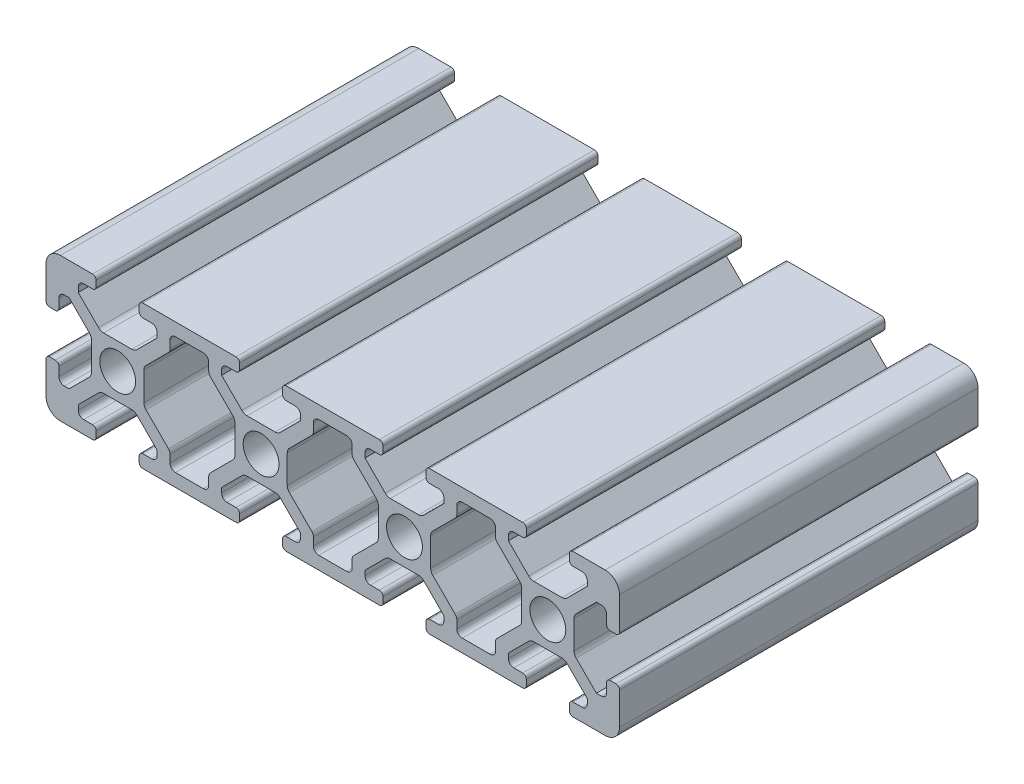
from build123d import *

# Parameters (mm, degrees)
SKETCH1_R           = 2.5
BOSS_EXTRUDE1_DEPTH = 50


with BuildPart() as part:
    # Sketch1 → Boss-Extrude1 (new body)
    with BuildSketch(Plane.XY):
        with BuildLine():
            Line((2, 0), (6.5, 0))
            ThreePointArc((6.5, 0), (6.853553391, 0.146446609), (7, 0.5))
            Line((7, 0.5), (7, 1.3))
            ThreePointArc((7, 1.3), (6.853553391, 1.653553391), (6.5, 1.8))
            Line((6.5, 1.8), (5.25, 1.8))
            ThreePointArc((5.25, 1.8), (4.719669914, 2.019669914), (4.5, 2.55))
            Line((4.5, 2.55), (4.5, 3.227207794))
            Line((4.5, 3.227207794), (7.329898987, 6.057106781))
            ThreePointArc((7.329898987, 6.057106781), (7.654322336, 6.273879533), (8.037005769, 6.35))
            Line((8.037005769, 6.35), (11.962994231, 6.35))
            ThreePointArc((11.962994231, 6.35), (12.345677664, 6.273879533), (12.670101013, 6.057106781))
            Line((12.670101013, 6.057106781), (15.5, 3.227207794))
            Line((15.5, 3.227207794), (15.5, 2.55))
            ThreePointArc((15.5, 2.55), (15.280330086, 2.019669914), (14.75, 1.8))
            Line((14.75, 1.8), (13.5, 1.8))
            ThreePointArc((13.5, 1.8), (13.146446609, 1.653553391), (13, 1.3))
            Line((13, 1.3), (13, 0.5))
            ThreePointArc((13, 0.5), (13.146446609, 0.146446609), (13.5, 0))
            Line((13.5, 0), (26.5, 0))
            ThreePointArc((26.5, 0), (26.853553391, 0.146446609), (27, 0.5))
            Line((27, 0.5), (27, 1.3))
            ThreePointArc((27, 1.3), (26.853553391, 1.653553391), (26.5, 1.8))
            Line((26.5, 1.8), (25.25, 1.8))
            ThreePointArc((25.25, 1.8), (24.719669914, 2.019669914), (24.5, 2.55))
            Line((24.5, 2.55), (24.5, 3.227207794))
            Line((24.5, 3.227207794), (27.329898987, 6.057106781))
            ThreePointArc((27.329898987, 6.057106781), (27.654322336, 6.273879533), (28.037005769, 6.35))
            Line((28.037005769, 6.35), (31.962994231, 6.35))
            ThreePointArc((31.962994231, 6.35), (32.345677664, 6.273879533), (32.670101013, 6.057106781))
            Line((32.670101013, 6.057106781), (35.5, 3.227207794))
            Line((35.5, 3.227207794), (35.5, 2.55))
            ThreePointArc((35.5, 2.55), (35.280330086, 2.019669914), (34.75, 1.8))
            Line((34.75, 1.8), (33.5, 1.8))
            ThreePointArc((33.5, 1.8), (33.146446609, 1.653553391), (33, 1.3))
            Line((33, 1.3), (33, 0.5))
            ThreePointArc((33, 0.5), (33.146446609, 0.146446609), (33.5, 0))
            Line((33.5, 0), (46.5, 0))
            ThreePointArc((46.5, 0), (46.853553391, 0.146446609), (47, 0.5))
            Line((47, 0.5), (47, 1.3))
            ThreePointArc((47, 1.3), (46.853553391, 1.653553391), (46.5, 1.8))
            Line((46.5, 1.8), (45.25, 1.8))
            ThreePointArc((45.25, 1.8), (44.719669914, 2.019669914), (44.5, 2.55))
            Line((44.5, 2.55), (44.5, 3.227207794))
            Line((44.5, 3.227207794), (47.329898987, 6.057106781))
            ThreePointArc((47.329898987, 6.057106781), (47.654322336, 6.273879533), (48.037005769, 6.35))
            Line((48.037005769, 6.35), (51.962994231, 6.35))
            ThreePointArc((51.962994231, 6.35), (52.345677664, 6.273879533), (52.670101013, 6.057106781))
            Line((52.670101013, 6.057106781), (55.5, 3.227207794))
            Line((55.5, 3.227207794), (55.5, 2.55))
            ThreePointArc((55.5, 2.55), (55.280330086, 2.019669914), (54.75, 1.8))
            Line((54.75, 1.8), (53.5, 1.8))
            ThreePointArc((53.5, 1.8), (53.146446609, 1.653553391), (53, 1.3))
            Line((53, 1.3), (53, 0.5))
            ThreePointArc((53, 0.5), (53.146446609, 0.146446609), (53.5, 0))
            Line((53.5, 0), (66.5, 0))
            ThreePointArc((66.5, 0), (66.853553391, 0.146446609), (67, 0.5))
            Line((67, 0.5), (67, 1.3))
            ThreePointArc((67, 1.3), (66.853553391, 1.653553391), (66.5, 1.8))
            Line((66.5, 1.8), (65.25, 1.8))
            ThreePointArc((65.25, 1.8), (64.719669914, 2.019669914), (64.5, 2.55))
            Line((64.5, 2.55), (64.5, 3.227207794))
            Line((64.5, 3.227207794), (67.329898987, 6.057106781))
            ThreePointArc((67.329898987, 6.057106781), (67.654322336, 6.273879533), (68.037005769, 6.35))
            Line((68.037005769, 6.35), (71.962994231, 6.35))
            ThreePointArc((71.962994231, 6.35), (72.345677664, 6.273879533), (72.670101013, 6.057106781))
            Line((72.670101013, 6.057106781), (75.5, 3.227207794))
            Line((75.5, 3.227207794), (75.5, 2.55))
            ThreePointArc((75.5, 2.55), (75.280330086, 2.019669914), (74.75, 1.8))
            Line((74.75, 1.8), (73.5, 1.8))
            ThreePointArc((73.5, 1.8), (73.146446609, 1.653553391), (73, 1.3))
            Line((73, 1.3), (73, 0.5))
            ThreePointArc((73, 0.5), (73.146446609, 0.146446609), (73.5, 0))
            Line((73.5, 0), (78, 0))
            ThreePointArc((78, 0), (79.414213562, 0.585786438), (80, 2))
            Line((80, 2), (80, 6.5))
            ThreePointArc((80, 6.5), (79.853553391, 6.853553391), (79.5, 7))
            Line((79.5, 7), (78.7, 7))
            ThreePointArc((78.7, 7), (78.346446609, 6.853553391), (78.2, 6.5))
            Line((78.2, 6.5), (78.2, 5.25))
            ThreePointArc((78.2, 5.25), (77.980330086, 4.719669914), (77.45, 4.5))
            Line((77.45, 4.5), (76.772792206, 4.5))
            Line((76.772792206, 4.5), (73.942893219, 7.329898987))
            ThreePointArc((73.942893219, 7.329898987), (73.726120467, 7.654322336), (73.65, 8.037005769))
            Line((73.65, 8.037005769), (73.65, 11.962994231))
            ThreePointArc((73.65, 11.962994231), (73.726120467, 12.345677664), (73.942893219, 12.670101013))
            Line((73.942893219, 12.670101013), (76.772792206, 15.5))
            Line((76.772792206, 15.5), (77.45, 15.5))
            ThreePointArc((77.45, 15.5), (77.980330086, 15.280330086), (78.2, 14.75))
            Line((78.2, 14.75), (78.2, 13.5))
            ThreePointArc((78.2, 13.5), (78.346446609, 13.146446609), (78.7, 13))
            Line((78.7, 13), (79.5, 13))
            ThreePointArc((79.5, 13), (79.853553391, 13.146446609), (80, 13.5))
            Line((80, 13.5), (80, 18))
            ThreePointArc((80, 18), (79.414213562, 19.414213562), (78, 20))
            Line((78, 20), (73.5, 20))
            ThreePointArc((73.5, 20), (73.146446609, 19.853553391), (73, 19.5))
            Line((73, 19.5), (73, 18.7))
            ThreePointArc((73, 18.7), (73.146446609, 18.346446609), (73.5, 18.2))
            Line((73.5, 18.2), (74.75, 18.2))
            ThreePointArc((74.75, 18.2), (75.280330086, 17.980330086), (75.5, 17.45))
            Line((75.5, 17.45), (75.5, 16.772792206))
            Line((75.5, 16.772792206), (72.670101013, 13.942893219))
            ThreePointArc((72.670101013, 13.942893219), (72.345677664, 13.726120467), (71.962994231, 13.65))
            Line((71.962994231, 13.65), (68.037005769, 13.65))
            ThreePointArc((68.037005769, 13.65), (67.654322336, 13.726120467), (67.329898987, 13.942893219))
            Line((67.329898987, 13.942893219), (64.5, 16.772792206))
            Line((64.5, 16.772792206), (64.5, 17.45))
            ThreePointArc((64.5, 17.45), (64.719669914, 17.980330086), (65.25, 18.2))
            Line((65.25, 18.2), (66.5, 18.2))
            ThreePointArc((66.5, 18.2), (66.853553391, 18.346446609), (67, 18.7))
            Line((67, 18.7), (67, 19.5))
            ThreePointArc((67, 19.5), (66.853553391, 19.853553391), (66.5, 20))
            Line((66.5, 20), (53.5, 20))
            ThreePointArc((53.5, 20), (53.146446609, 19.853553391), (53, 19.5))
            Line((53, 19.5), (53, 18.7))
            ThreePointArc((53, 18.7), (53.146446609, 18.346446609), (53.5, 18.2))
            Line((53.5, 18.2), (54.75, 18.2))
            ThreePointArc((54.75, 18.2), (55.280330086, 17.980330086), (55.5, 17.45))
            Line((55.5, 17.45), (55.5, 16.772792206))
            Line((55.5, 16.772792206), (52.670101013, 13.942893219))
            ThreePointArc((52.670101013, 13.942893219), (52.345677664, 13.726120467), (51.962994231, 13.65))
            Line((51.962994231, 13.65), (48.037005769, 13.65))
            ThreePointArc((48.037005769, 13.65), (47.654322336, 13.726120467), (47.329898987, 13.942893219))
            Line((47.329898987, 13.942893219), (44.5, 16.772792206))
            Line((44.5, 16.772792206), (44.5, 17.45))
            ThreePointArc((44.5, 17.45), (44.719669914, 17.980330086), (45.25, 18.2))
            Line((45.25, 18.2), (46.5, 18.2))
            ThreePointArc((46.5, 18.2), (46.853553391, 18.346446609), (47, 18.7))
            Line((47, 18.7), (47, 19.5))
            ThreePointArc((47, 19.5), (46.853553391, 19.853553391), (46.5, 20))
            Line((46.5, 20), (33.5, 20))
            ThreePointArc((33.5, 20), (33.146446609, 19.853553391), (33, 19.5))
            Line((33, 19.5), (33, 18.7))
            ThreePointArc((33, 18.7), (33.146446609, 18.346446609), (33.5, 18.2))
            Line((33.5, 18.2), (34.75, 18.2))
            ThreePointArc((34.75, 18.2), (35.280330086, 17.980330086), (35.5, 17.45))
            Line((35.5, 17.45), (35.5, 16.772792206))
            Line((35.5, 16.772792206), (32.670101013, 13.942893219))
            ThreePointArc((32.670101013, 13.942893219), (32.345677664, 13.726120467), (31.962994231, 13.65))
            Line((31.962994231, 13.65), (28.037005769, 13.65))
            ThreePointArc((28.037005769, 13.65), (27.654322336, 13.726120467), (27.329898987, 13.942893219))
            Line((27.329898987, 13.942893219), (24.5, 16.772792206))
            Line((24.5, 16.772792206), (24.5, 17.45))
            ThreePointArc((24.5, 17.45), (24.719669914, 17.980330086), (25.25, 18.2))
            Line((25.25, 18.2), (26.5, 18.2))
            ThreePointArc((26.5, 18.2), (26.853553391, 18.346446609), (27, 18.7))
            Line((27, 18.7), (27, 19.5))
            ThreePointArc((27, 19.5), (26.853553391, 19.853553391), (26.5, 20))
            Line((26.5, 20), (13.5, 20))
            ThreePointArc((13.5, 20), (13.146446609, 19.853553391), (13, 19.5))
            Line((13, 19.5), (13, 18.7))
            ThreePointArc((13, 18.7), (13.146446609, 18.346446609), (13.5, 18.2))
            Line((13.5, 18.2), (14.75, 18.2))
            ThreePointArc((14.75, 18.2), (15.280330086, 17.980330086), (15.5, 17.45))
            Line((15.5, 17.45), (15.5, 16.772792206))
            Line((15.5, 16.772792206), (12.670101013, 13.942893219))
            ThreePointArc((12.670101013, 13.942893219), (12.345677664, 13.726120467), (11.962994231, 13.65))
            Line((11.962994231, 13.65), (8.037005769, 13.65))
            ThreePointArc((8.037005769, 13.65), (7.654322336, 13.726120467), (7.329898987, 13.942893219))
            Line((7.329898987, 13.942893219), (4.5, 16.772792206))
            Line((4.5, 16.772792206), (4.5, 17.45))
            ThreePointArc((4.5, 17.45), (4.719669914, 17.980330086), (5.25, 18.2))
            Line((5.25, 18.2), (6.5, 18.2))
            ThreePointArc((6.5, 18.2), (6.853553391, 18.346446609), (7, 18.7))
            Line((7, 18.7), (7, 19.5))
            ThreePointArc((7, 19.5), (6.853553391, 19.853553391), (6.5, 20))
            Line((6.5, 20), (2, 20))
            ThreePointArc((2, 20), (0.585786438, 19.414213562), (0, 18))
            Line((0, 18), (0, 13.5))
            ThreePointArc((0, 13.5), (0.146446609, 13.146446609), (0.5, 13))
            Line((0.5, 13), (1.3, 13))
            ThreePointArc((1.3, 13), (1.653553391, 13.146446609), (1.8, 13.5))
            Line((1.8, 13.5), (1.8, 14.75))
            ThreePointArc((1.8, 14.75), (2.019669914, 15.280330086), (2.55, 15.5))
            Line((2.55, 15.5), (3.227207794, 15.5))
            Line((3.227207794, 15.5), (6.057106781, 12.670101013))
            ThreePointArc((6.057106781, 12.670101013), (6.273879533, 12.345677664), (6.35, 11.962994231))
            Line((6.35, 11.962994231), (6.35, 8.037005769))
            ThreePointArc((6.35, 8.037005769), (6.273879533, 7.654322336), (6.057106781, 7.329898987))
            Line((6.057106781, 7.329898987), (3.227207794, 4.5))
            Line((3.227207794, 4.5), (2.55, 4.5))
            ThreePointArc((2.55, 4.5), (2.019669914, 4.719669914), (1.8, 5.25))
            Line((1.8, 5.25), (1.8, 6.5))
            ThreePointArc((1.8, 6.5), (1.653553391, 6.853553391), (1.3, 7))
            Line((1.3, 7), (0.5, 7))
            ThreePointArc((0.5, 7), (0.146446609, 6.853553391), (0, 6.5))
            Line((0, 6.5), (0, 2))
            ThreePointArc((0, 2), (0.585786438, 0.585786438), (2, 0))
        make_face()
        with Locations((10, 10)):
            Circle(SKETCH1_R, mode=Mode.SUBTRACT)
        with Locations((30, 10)):
            Circle(SKETCH1_R, mode=Mode.SUBTRACT)
        with Locations((50, 10)):
            Circle(SKETCH1_R, mode=Mode.SUBTRACT)
        with Locations((70, 10)):
            Circle(SKETCH1_R, mode=Mode.SUBTRACT)
        with BuildLine():
            Line((33.942893219, 12.670101013), (37.080330086, 15.80753788))
            ThreePointArc((37.080330086, 15.80753788), (37.242909649, 16.050855391), (37.3, 16.337867966))
            Line((37.3, 16.337867966), (37.3, 17.45))
            ThreePointArc((37.3, 17.45), (37.519669914, 17.980330086), (38.05, 18.2))
            Line((38.05, 18.2), (41.95, 18.2))
            ThreePointArc((41.95, 18.2), (42.480330086, 17.980330086), (42.7, 17.45))
            Line((42.7, 17.45), (42.7, 16.337867966))
            ThreePointArc((42.7, 16.337867966), (42.757090351, 16.050855391), (42.919669914, 15.80753788))
            Line((42.919669914, 15.80753788), (46.057106781, 12.670101013))
            ThreePointArc((46.057106781, 12.670101013), (46.273879533, 12.345677664), (46.35, 11.962994231))
            Line((46.35, 11.962994231), (46.35, 8.037005769))
            ThreePointArc((46.35, 8.037005769), (46.273879533, 7.654322336), (46.057106781, 7.329898987))
            Line((46.057106781, 7.329898987), (42.919669914, 4.19246212))
            ThreePointArc((42.919669914, 4.19246212), (42.757090351, 3.949144609), (42.7, 3.662132034))
            Line((42.7, 3.662132034), (42.7, 2.55))
            ThreePointArc((42.7, 2.55), (42.480330086, 2.019669914), (41.95, 1.8))
            Line((41.95, 1.8), (38.05, 1.8))
            ThreePointArc((38.05, 1.8), (37.519669914, 2.019669914), (37.3, 2.55))
            Line((37.3, 2.55), (37.3, 3.662132034))
            ThreePointArc((37.3, 3.662132034), (37.242909649, 3.949144609), (37.080330086, 4.19246212))
            Line((37.080330086, 4.19246212), (33.942893219, 7.329898987))
            ThreePointArc((33.942893219, 7.329898987), (33.726120467, 7.654322336), (33.65, 8.037005769))
            Line((33.65, 8.037005769), (33.65, 11.962994231))
            ThreePointArc((33.65, 11.962994231), (33.726120467, 12.345677664), (33.942893219, 12.670101013))
        make_face(mode=Mode.SUBTRACT)
        with BuildLine():
            Line((22.919669914, 15.80753788), (26.057106781, 12.670101013))
            ThreePointArc((26.057106781, 12.670101013), (26.273879533, 12.345677664), (26.35, 11.962994231))
            Line((26.35, 11.962994231), (26.35, 8.037005769))
            ThreePointArc((26.35, 8.037005769), (26.273879533, 7.654322336), (26.057106781, 7.329898987))
            Line((26.057106781, 7.329898987), (22.919669914, 4.19246212))
            ThreePointArc((22.919669914, 4.19246212), (22.757090351, 3.949144609), (22.7, 3.662132034))
            Line((22.7, 3.662132034), (22.7, 2.55))
            ThreePointArc((22.7, 2.55), (22.480330086, 2.019669914), (21.95, 1.8))
            Line((21.95, 1.8), (18.05, 1.8))
            ThreePointArc((18.05, 1.8), (17.519669914, 2.019669914), (17.3, 2.55))
            Line((17.3, 2.55), (17.3, 3.662132034))
            ThreePointArc((17.3, 3.662132034), (17.242909649, 3.949144609), (17.080330086, 4.19246212))
            Line((17.080330086, 4.19246212), (13.942893219, 7.329898987))
            ThreePointArc((13.942893219, 7.329898987), (13.726120467, 7.654322336), (13.65, 8.037005769))
            Line((13.65, 8.037005769), (13.65, 11.962994231))
            ThreePointArc((13.65, 11.962994231), (13.726120467, 12.345677664), (13.942893219, 12.670101013))
            Line((13.942893219, 12.670101013), (17.080330086, 15.80753788))
            ThreePointArc((17.080330086, 15.80753788), (17.242909649, 16.050855391), (17.3, 16.337867966))
            Line((17.3, 16.337867966), (17.3, 17.45))
            ThreePointArc((17.3, 17.45), (17.519669914, 17.980330086), (18.05, 18.2))
            Line((18.05, 18.2), (21.95, 18.2))
            ThreePointArc((21.95, 18.2), (22.480330086, 17.980330086), (22.7, 17.45))
            Line((22.7, 17.45), (22.7, 16.337867966))
            ThreePointArc((22.7, 16.337867966), (22.757090351, 16.050855391), (22.919669914, 15.80753788))
        make_face(mode=Mode.SUBTRACT)
        with BuildLine():
            Line((62.919669914, 15.80753788), (66.057106781, 12.670101013))
            ThreePointArc((66.057106781, 12.670101013), (66.273879533, 12.345677664), (66.35, 11.962994231))
            Line((66.35, 11.962994231), (66.35, 8.037005769))
            ThreePointArc((66.35, 8.037005769), (66.273879533, 7.654322336), (66.057106781, 7.329898987))
            Line((66.057106781, 7.329898987), (62.919669914, 4.19246212))
            ThreePointArc((62.919669914, 4.19246212), (62.757090351, 3.949144609), (62.7, 3.662132034))
            Line((62.7, 3.662132034), (62.7, 2.55))
            ThreePointArc((62.7, 2.55), (62.480330086, 2.019669914), (61.95, 1.8))
            Line((61.95, 1.8), (58.05, 1.8))
            ThreePointArc((58.05, 1.8), (57.519669914, 2.019669914), (57.3, 2.55))
            Line((57.3, 2.55), (57.3, 3.662132034))
            ThreePointArc((57.3, 3.662132034), (57.242909649, 3.949144609), (57.080330086, 4.19246212))
            Line((57.080330086, 4.19246212), (53.942893219, 7.329898987))
            ThreePointArc((53.942893219, 7.329898987), (53.726120467, 7.654322336), (53.65, 8.037005769))
            Line((53.65, 8.037005769), (53.65, 11.962994231))
            ThreePointArc((53.65, 11.962994231), (53.726120467, 12.345677664), (53.942893219, 12.670101013))
            Line((53.942893219, 12.670101013), (57.080330086, 15.80753788))
            ThreePointArc((57.080330086, 15.80753788), (57.242909649, 16.050855391), (57.3, 16.337867966))
            Line((57.3, 16.337867966), (57.3, 17.45))
            ThreePointArc((57.3, 17.45), (57.519669914, 17.980330086), (58.05, 18.2))
            Line((58.05, 18.2), (61.95, 18.2))
            ThreePointArc((61.95, 18.2), (62.480330086, 17.980330086), (62.7, 17.45))
            Line((62.7, 17.45), (62.7, 16.337867966))
            ThreePointArc((62.7, 16.337867966), (62.757090351, 16.050855391), (62.919669914, 15.80753788))
        make_face(mode=Mode.SUBTRACT)
    extrude(amount=BOSS_EXTRUDE1_DEPTH)


solid = part.part
